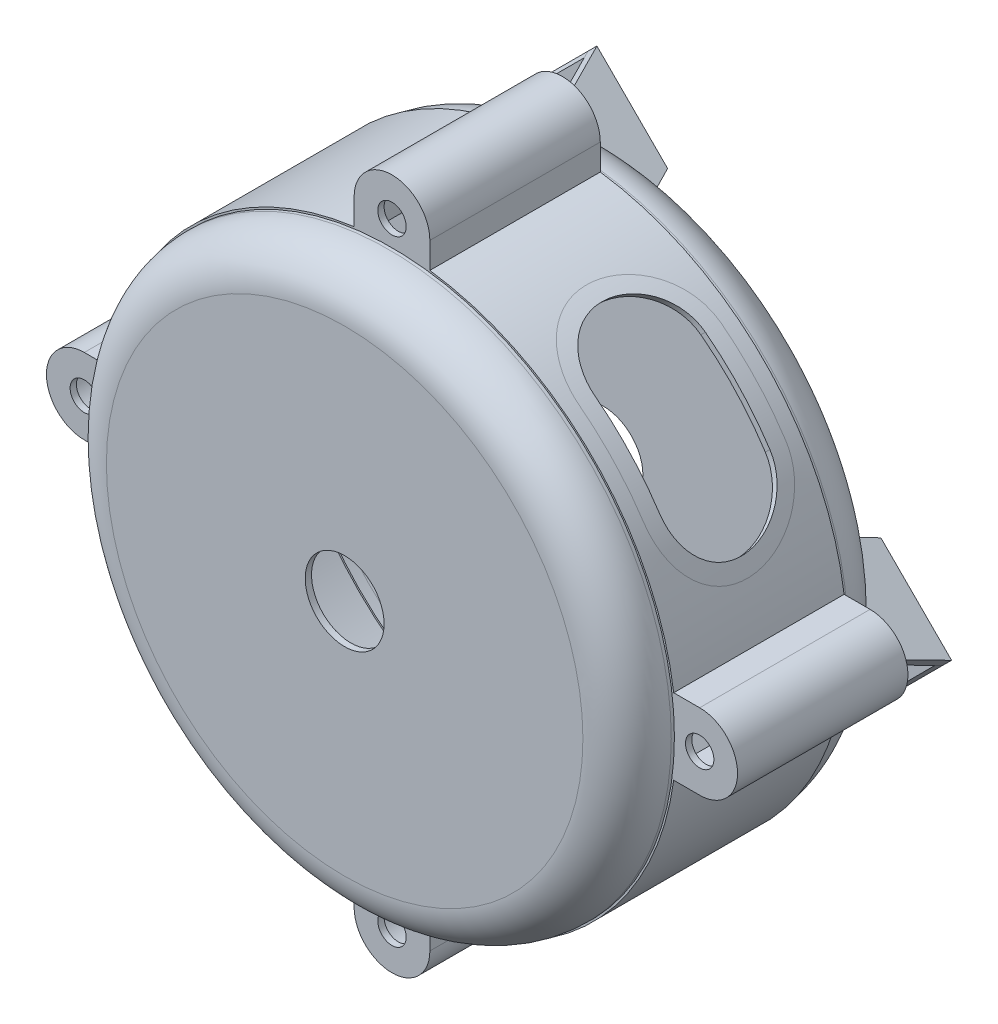
from build123d import *

# Parameters (mm, degrees)
BOSS_EXTRUDE1_DEPTH = 100
SKETCH3_R           = 175
BOSS_EXTRUDE2_DEPTH = 30
BOSS_EXTRUDE3_START = 30
SKETCH4_R           = 175
BOSS_EXTRUDE3_DEPTH = 30
FILLET1_R           = 24
SKETCH5_R           = 25
CUT_EXTRUDE2_DEPTH  = 344.584050852
SHELL7_T            = 4
CUT_EXTRUDE3_DEPTH  = 338.458145553
SKETCH14_R          = 9
CUT_EXTRUDE4_DEPTH  = 340.066365185
CUT_EXTRUDE5_DEPTH  = 50
BOSS_EXTRUDE4_DEPTH = 0.01
BOSS_EXTRUDE5_DEPTH = 0.01
BOSS_EXTRUDE6_DEPTH = 86.992488
BOSS_EXTRUDE7_REACH = 382.21
SKETCH22_W          = 4
SKETCH22_H          = 55.598775965


with BuildPart() as part:
    # Sketch1 → Boss-Extrude1 (new body)
    with BuildSketch(Plane.XY):
        with BuildLine():
            Line((175, 20), (195, 20))
            ThreePointArc((195, 20), (215, 0), (195, -20))
            Line((195, -20), (175, -20))
            ThreePointArc((175, -20), (124.549187071, -124.549187071), (20, -175))
            Line((20, -175), (20, -195))
            ThreePointArc((20, -195), (0, -215), (-20, -195))
            Line((-20, -195), (-20, -175))
            ThreePointArc((-20, -175), (-124.549187071, -124.549187071), (-175, -20))
            Line((-175, -20), (-195, -20))
            ThreePointArc((-195, -20), (-215, 0), (-195, 20))
            Line((-195, 20), (-175, 20))
            ThreePointArc((-175, 20), (-124.549187071, 124.549187071), (-20, 175))
            Line((-20, 175), (-20, 195))
            ThreePointArc((-20, 195), (0, 215), (20, 195))
            Line((20, 195), (20, 175))
            ThreePointArc((20, 175), (124.549187071, 124.549187071), (175, 20))
        make_face()
    extrude(amount=BOSS_EXTRUDE1_DEPTH)

    # Sketch3 → Boss-Extrude2 (add)
    with BuildSketch(Plane.XY.offset(100)):
        Circle(SKETCH3_R)
    extrude(amount=BOSS_EXTRUDE2_DEPTH)

    # Sketch4 → Boss-Extrude3 (add)
    with BuildSketch(Plane(origin=(0, 0, 0), x_dir=(-1, 0, 0), z_dir=(0, 0, -1)).offset(BOSS_EXTRUDE3_START)):
        with Locations(Location((0, 0, 0), (0, 0, 180))):
            Circle(SKETCH4_R)
    extrude(amount=-BOSS_EXTRUDE3_DEPTH)

    # Fillet1
    fillet1_edges = [part.edges().sort_by_distance(p)[0] for p in [
        (-175, 0, 130),
        (-175, 0, -30),
    ]]
    fillet(fillet1_edges, radius=FILLET1_R)

    # Sketch5 → Cut-Extrude2 (cut, through all)
    with BuildSketch(Plane.XY.offset(130)):
        Circle(SKETCH5_R)
    extrude(amount=-CUT_EXTRUDE2_DEPTH, mode=Mode.SUBTRACT)

    # Shell7
    shell7_openings = [part.faces().sort_by_distance(p)[0] for p in [
        (-25, 0, 50),
    ]]
    offset(amount=SHELL7_T, openings=shell7_openings, kind=Kind.INTERSECTION)

    # Sketch11<2> → Cut-Extrude3 (cut, through all)
    with BuildSketch(Plane(origin=(0, 0, 0), x_dir=(0, 0, -1), z_dir=(0.7071067811865464, 0.7071067811865488, 0))):
        with BuildLine():
            Line((-15, 23.596648043), (-15, -36.403351957))
            ThreePointArc((-15, -36.403351957), (-50, -71.403351957), (-85, -36.403351957))
            Line((-85, -36.403351957), (-85, 23.596648043))
            ThreePointArc((-85, 23.596648043), (-50, 58.596648043), (-15, 23.596648043))
        make_face()
    extrude(amount=CUT_EXTRUDE3_DEPTH, mode=Mode.SUBTRACT)

    # Sketch14 → Cut-Extrude4 (cut, through all)
    with BuildSketch(Plane(origin=(0, 0, -4), x_dir=(-1, 0, 0), z_dir=(0, 0, -1))):
        with Locations((0, 195)):
            Circle(SKETCH14_R)
        with Locations((195, 0)):
            Circle(SKETCH14_R)
        with Locations((0, -195)):
            Circle(SKETCH14_R)
        with Locations((-195, 0)):
            Circle(SKETCH14_R)
    extrude(amount=-CUT_EXTRUDE4_DEPTH, mode=Mode.SUBTRACT)

    # Sketch16 → Cut-Extrude5 (cut)
    with BuildSketch(Plane(origin=(0, 0, -34), x_dir=(-1, 0, 0), z_dir=(0, 0, -1))):
        Polygon((57.440652839, 122.638470914), (118.953630829, 61.125492923), (79.639359319, 21.811221413), (18.126381328, 83.324199404), align=None)
    cut_extrude5 = extrude(amount=-CUT_EXTRUDE5_DEPTH, mode=Mode.SUBTRACT)

    # Mirror2: Cut-Extrude5 across plane
    add(cut_extrude5.mirror(Plane(origin=(0, 0, 0), x_dir=(0, 0, 1), z_dir=(-0.7071067811865488, 0.7071067811865464, 0))), mode=Mode.SUBTRACT)

    # Sketch22 → Boss-Extrude7 (add, up to next)
    with BuildSketch(Plane(origin=(32.598909038, 32.598909038, 0), x_dir=(0, 0, 1), z_dir=(-0.7071067811865565, -0.7071067811865387, 0)), mode=Mode.PRIVATE) as boss_extrude7_sk1:
        with Locations((-32, 99.535781574)):
            Rectangle(SKETCH22_W, SKETCH22_H)
    boss_extrude7_tool1 = extrude(boss_extrude7_sk1.sketch, amount=BOSS_EXTRUDE7_REACH, mode=Mode.PRIVATE) - part.part
    add(boss_extrude7_tool1.solids().sort_by_distance((-37.783517, 102.981335, -32))[0])


with BuildPart() as body_2:
    # Sketch18 → Boss-Extrude4 (new body)
    with BuildSketch(Plane.XY.offset(-100)):
        Polygon((-29.298235709, 105.809762284), (-74.128805636, 150.640332211), (-79.785659886, 144.983477961), (-40.611944208, 105.809762284), (-102.124922199, 44.296784293), (-141.298637877, 83.470499971), (-146.955492126, 77.813645721), (-102.124922199, 32.983075794), align=None)
    extrude(amount=BOSS_EXTRUDE4_DEPTH)


with BuildPart() as body_3:
    # Sketch17 → Boss-Extrude5 (new body)
    with BuildSketch(Plane(origin=(0, 0, -34), x_dir=(-1, 0, 0), z_dir=(0, 0, -1))):
        Polygon((57.440652839, 122.638470914), (51.783798589, 128.295325164), (6.812672829, 83.324199404), (79.639359319, 10.497512914), (124.610485079, 55.468638674), (118.953630829, 61.125492923), (79.639359319, 21.811221413), (18.126381328, 83.324199404), align=None)
    extrude(amount=BOSS_EXTRUDE5_DEPTH)


    add(body_2.part)  # loft1 joins it to this body
    # loft from a face of the part (loft1)
    loft([body_3.faces().sort_by_distance((-53.434247591, 124.288919916, -34.01))[0], body_3.faces().sort_by_distance((-52.890093237, 127.048474683, -99.99))[0]])

    # Sketch19 → Boss-Extrude6 (add)
    with BuildSketch(Plane(origin=(-28.914068953, -28.914068953, 0), x_dir=(0, 0, -1), z_dir=(0.7071067811865566, 0.7071067811865385, 0))):
        Polygon((100, 158.935781573), (96.390556747, 157.211855994), (96.390556747, 101.801012059), (100, 103.535781573), align=None)
    extrude(amount=BOSS_EXTRUDE6_DEPTH)


with BuildPart() as body_3_2:
    # Mirror1: mirrored copy
    add(body_3.part.mirror(Plane(origin=(0, 0, 0), x_dir=(0, 0, 1), z_dir=(-0.7071067811865488, 0.7071067811865464, 0))))


solid = Compound([part.part, body_3.part, body_3_2.part])
